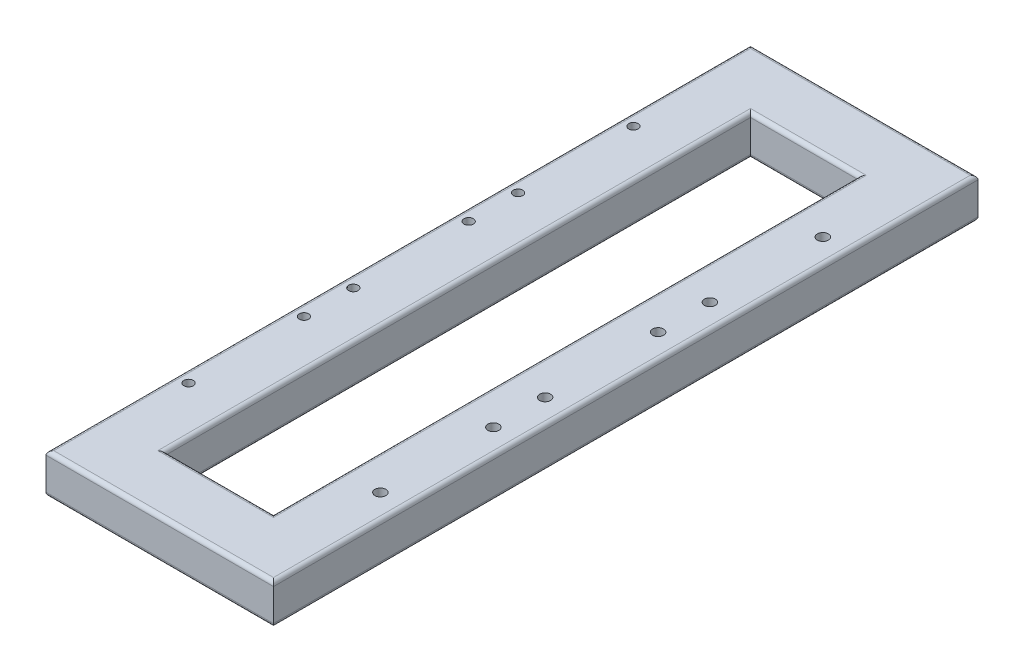
from build123d import *

# Parameters (mm, degrees)
CROQUIS1_W              = 290
CROQUIS1_H              = 898
CROQUIS1_R              = 6
CROQUIS1_R_2            = 7
CROQUIS1_W_2            = 137.6
CROQUIS1_H_2            = 745.6
SALIENTE_EXTRUIR1_DEPTH = 50.8
REDONDEO1_R             = 5
REDONDEO2_R             = 5


with BuildPart() as part:
    # Croquis1 → Saliente-Extruir1 (new body)
    with BuildSketch(Plane(origin=(0, 0, 0), x_dir=(1, 0, 0), z_dir=(0, 1, 0))):
        with Locations((-145, 449)):
            Rectangle(CROQUIS1_W, CROQUIS1_H)
        with Locations(Location((-273.75, 375.5, 0), (0, 0, 270))):
            Circle(CROQUIS1_R, mode=Mode.SUBTRACT)
        with Locations(Location((-273.75, 522.5, 0), (0, 0, 270))):
            Circle(CROQUIS1_R, mode=Mode.SUBTRACT)
        with Locations(Location((-30.75, 377, 0), (0, 0, 270))):
            Circle(CROQUIS1_R_2, mode=Mode.SUBTRACT)
        with Locations(Location((-30.75, 521, 0), (0, 0, 270))):
            Circle(CROQUIS1_R_2, mode=Mode.SUBTRACT)
        with Locations(Location((-30.75, 167, 0), (0, 0, 270))):
            Circle(CROQUIS1_R_2, mode=Mode.SUBTRACT)
        with Locations(Location((-273.75, 732.5, 0), (0, 0, 90))):
            Circle(CROQUIS1_R, mode=Mode.SUBTRACT)
        with Locations(Location((-273.75, 312.5, 0), (0, 0, 270))):
            Circle(CROQUIS1_R, mode=Mode.SUBTRACT)
        with Locations(Location((-30.75, 311, 0), (0, 0, 270))):
            Circle(CROQUIS1_R_2, mode=Mode.SUBTRACT)
        with Locations(Location((-273.75, 165.5, 0), (0, 0, 270))):
            Circle(CROQUIS1_R, mode=Mode.SUBTRACT)
        with Locations(Location((-30.75, 587, 0), (0, 0, 90))):
            Circle(CROQUIS1_R_2, mode=Mode.SUBTRACT)
        with Locations(Location((-273.75, 585.5, 0), (0, 0, 90))):
            Circle(CROQUIS1_R, mode=Mode.SUBTRACT)
        with Locations(Location((-30.75, 731, 0), (0, 0, 90))):
            Circle(CROQUIS1_R_2, mode=Mode.SUBTRACT)
        with Locations((-145, 449)):
            Rectangle(CROQUIS1_W_2, CROQUIS1_H_2, mode=Mode.SUBTRACT)
    extrude(amount=SALIENTE_EXTRUIR1_DEPTH)

    # Redondeo1
    redondeo1_edges = [part.edges().sort_by_distance(p)[0] for p in [
        (-290, 50.8, -449),
        (-145, 50.8, 0),
        (-76.2, 50.8, -449),
        (-145, 50.8, -821.8),
        (-213.8, 50.8, -449),
        (-145, 50.8, -76.2),
        (0, 50.8, -449),
        (-145, 50.8, -898),
    ]]
    fillet(redondeo1_edges, radius=REDONDEO1_R)

    # Redondeo2
    redondeo2_edges = [part.edges().sort_by_distance(p)[0] for p in [
        (-76.2, 0, -449),
        (-145, 0, -821.8),
        (-213.8, 0, -449),
        (-145, 0, -76.2),
        (-145, 0, 0),
        (-290, 0, -449),
        (-145, 0, -898),
        (0, 0, -449),
    ]]
    fillet(redondeo2_edges, radius=REDONDEO2_R)


solid = part.part
